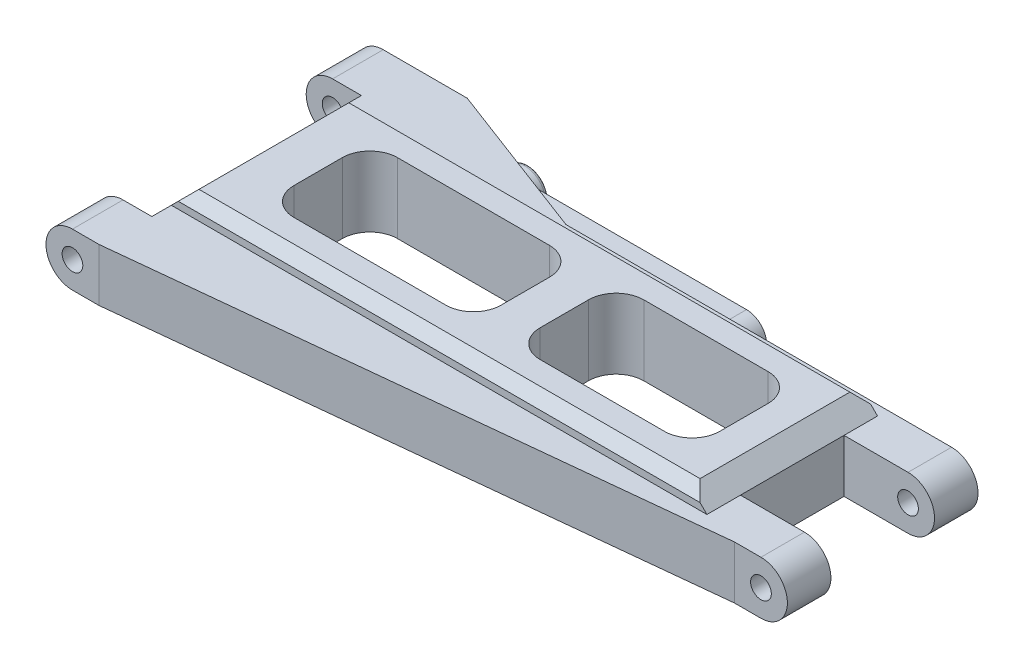
from build123d import *

# Parameters (mm, degrees)
SKETCH1_R           = 1.5
BOSS_EXTRUDE1_DEPTH = 22.5
SKETCH2_W           = 3.83
SKETCH2_H           = 8.7
SKETCH2_W_2         = 8
SKETCH2_H_2         = 30.35
SKETCH2_W_3         = 13.1
SKETCH2_H_3         = 15
CUT_EXTRUDE1_DEPTH  = 55.757415023
BOSS_EXTRUDE2_START = 6.33
SKETCH3_W           = 77.56
SKETCH3_H           = 24.7
BOSS_EXTRUDE2_DEPTH = 6.33
CHAMFER1_SIZE       = 2.5
CHAMFER2_SIZE       = 1.5
BOSS_EXTRUDE3_DEPTH = 3.31
SKETCH5_R           = 3
BOSS_EXTRUDE4_DEPTH = 2.4
FILLET1_R           = 0.5
SKETCH6_R           = 1.25
CUT_EXTRUDE2_DEPTH  = 10


with BuildPart() as part:
    # Sketch1 → Boss-Extrude1 (new, symmetric)
    with BuildSketch(Plane.XY):
        with BuildLine():
            Line((-45.5, 3.83), (45.5, 3.83))
            ThreePointArc((45.5, 3.83), (49.33, 0), (45.5, -3.83))
            Line((45.5, -3.83), (-45.5, -3.83))
            ThreePointArc((-45.5, -3.83), (-49.33, 0), (-45.5, 3.83))
        make_face()
        with Locations(Location((-45.5, 0, 0), (0, 0, 180))):
            Circle(SKETCH1_R, mode=Mode.SUBTRACT)
        with Locations(Location((45.5, 0, 0), (0, 0, 180))):
            Circle(SKETCH1_R, mode=Mode.SUBTRACT)
    extrude(amount=BOSS_EXTRUDE1_DEPTH, both=True)

    # Sketch2 → Cut-Extrude1 (cut, through all)
    with BuildSketch(Plane(origin=(0, 3.83, 0), x_dir=(1, 0, 0), z_dir=(0, 1, 0))):
        Polygon((-10.33, 13.8), (45.5, 13.8), (45.5, 22.5), (-33.33, 22.5), align=None)
        Polygon((41.67, -13.8), (-41.67, -22.5), (45.5, -22.5), (45.5, -13.8), align=None)
        with Locations((47.415, -18.15)):
            Rectangle(SKETCH2_W, SKETCH2_H)
        with Locations((47.415, 18.15)):
            Rectangle(SKETCH2_W, SKETCH2_H)
        with BuildLine():
            Line((-6.43, 7.5), (-28.43, 7.5))
            ThreePointArc((-28.43, 7.5), (-31.258427125, 6.328427125), (-32.43, 3.5))
            Line((-32.43, 3.5), (-32.43, -3.5))
            ThreePointArc((-32.43, -3.5), (-31.258427125, -6.328427125), (-28.43, -7.5))
            Line((-28.43, -7.5), (-6.43, -7.5))
            ThreePointArc((-6.43, -7.5), (-3.601572875, -6.328427125), (-2.43, -3.5))
            Line((-2.43, -3.5), (-2.43, 3.5))
            ThreePointArc((-2.43, 3.5), (-3.601572875, 6.328427125), (-6.43, 7.5))
        make_face()
        with BuildLine():
            Line((25.23, 7.5), (7.23, 7.5))
            ThreePointArc((7.23, 7.5), (4.401572875, 6.328427125), (3.23, 3.5))
            Line((3.23, 3.5), (3.23, -3.5))
            ThreePointArc((3.23, -3.5), (4.401572875, -6.328427125), (7.23, -7.5))
            Line((7.23, -7.5), (25.23, -7.5))
            ThreePointArc((25.23, -7.5), (28.058427125, -6.328427125), (29.23, -3.5))
            Line((29.23, -3.5), (29.23, 3.5))
            ThreePointArc((29.23, 3.5), (28.058427125, 6.328427125), (25.23, 7.5))
        make_face()
        with Locations((-45.33, 0)):
            Rectangle(SKETCH2_W_2, SKETCH2_H_2)
        with Locations((42.78, 0)):
            Rectangle(SKETCH2_W_3, SKETCH2_H_3)
    extrude(amount=-CUT_EXTRUDE1_DEPTH, mode=Mode.SUBTRACT)

    # Sketch3 → Boss-Extrude2 (add)
    with BuildSketch(Plane(origin=(0, 0, 0), x_dir=(1, 0, 0), z_dir=(0, 1, 0)).offset(BOSS_EXTRUDE2_START)):
        with Locations((-2.55, 0)):
            Rectangle(SKETCH3_W, SKETCH3_H)
        with BuildLine():
            ThreePointArc((3.23, -3.5), (4.401572875, -6.328427125), (7.23, -7.5))
            Line((7.23, -7.5), (25.23, -7.5))
            ThreePointArc((25.23, -7.5), (28.058427125, -6.328427125), (29.23, -3.5))
            Line((29.23, -3.5), (29.23, 3.5))
            ThreePointArc((29.23, 3.5), (28.058427125, 6.328427125), (25.23, 7.5))
            Line((25.23, 7.5), (7.23, 7.5))
            ThreePointArc((7.23, 7.5), (4.401572875, 6.328427125), (3.23, 3.5))
            Line((3.23, 3.5), (3.23, -3.5))
        make_face(mode=Mode.SUBTRACT)
        with BuildLine():
            ThreePointArc((-32.43, -3.5), (-31.258427125, -6.328427125), (-28.43, -7.5))
            Line((-28.43, -7.5), (-6.43, -7.5))
            ThreePointArc((-6.43, -7.5), (-3.601572875, -6.328427125), (-2.43, -3.5))
            Line((-2.43, -3.5), (-2.43, 3.5))
            ThreePointArc((-2.43, 3.5), (-3.601572875, 6.328427125), (-6.43, 7.5))
            Line((-6.43, 7.5), (-28.43, 7.5))
            ThreePointArc((-28.43, 7.5), (-31.258427125, 6.328427125), (-32.43, 3.5))
            Line((-32.43, 3.5), (-32.43, -3.5))
        make_face(mode=Mode.SUBTRACT)
    extrude(amount=-BOSS_EXTRUDE2_DEPTH)

    # Chamfer1
    chamfer1_edges = [part.edges().sort_by_distance(p)[0] for p in [
        (36.23, 6.33, 0),
        (-41.33, 6.33, 0),
    ]]
    chamfer(chamfer1_edges, length=CHAMFER1_SIZE)

    # Chamfer2
    chamfer2_edges = [part.edges().sort_by_distance(p)[0] for p in [
        (-2.55, 6.33, 12.35),
        (-2.55, 6.33, -12.35),
    ]]
    chamfer(chamfer2_edges, length=CHAMFER2_SIZE)

    # Sketch4 → Boss-Extrude3 (add)
    with BuildSketch(Plane(origin=(0, 0, -13.8), x_dir=(-1, 0, 0), z_dir=(0, 0, -1))):
        with BuildLine():
            Line((21.5, -2.93), (-12.5, -2.93))
            ThreePointArc((-12.5, -2.93), (-15.43, 0), (-12.5, 2.93))
            Line((-12.5, 2.93), (21.5, 2.93))
            ThreePointArc((21.5, 2.93), (24.43, 0), (21.5, -2.93))
        make_face()
    extrude(amount=BOSS_EXTRUDE3_DEPTH)

    # Sketch5 → Boss-Extrude4 (add)
    with BuildSketch(Plane(origin=(0, 0, -17.11), x_dir=(-1, 0, 0), z_dir=(0, 0, -1))):
        with Locations(Location((21.5, 0, 0), (0, 0, 216.247045378))):
            Circle(SKETCH5_R)
    extrude(amount=BOSS_EXTRUDE4_DEPTH)

    # Fillet1
    fillet1_edges = [part.edges().sort_by_distance(p)[0] for p in [
        (-23.919425287, 1.773804183, -19.51),
    ]]
    fillet(fillet1_edges, radius=FILLET1_R)

    # Sketch6 → Cut-Extrude2 (cut)
    with BuildSketch(Plane(origin=(0, 0, -19.51), x_dir=(-1, 0, 0), z_dir=(0, 0, -1))):
        with Locations((21.5, 0)):
            Circle(SKETCH6_R)
        with Locations((9.1, 0)):
            Circle(SKETCH6_R)
        with Locations((1.9, 0)):
            Circle(SKETCH6_R)
        with Locations((-5.3, 0)):
            Circle(SKETCH6_R)
        with Locations((-12.5, 0)):
            Circle(SKETCH6_R)
        with Locations((-8.9, 0)):
            Circle(SKETCH6_R)
    extrude(amount=-CUT_EXTRUDE2_DEPTH, mode=Mode.SUBTRACT)


solid = part.part
